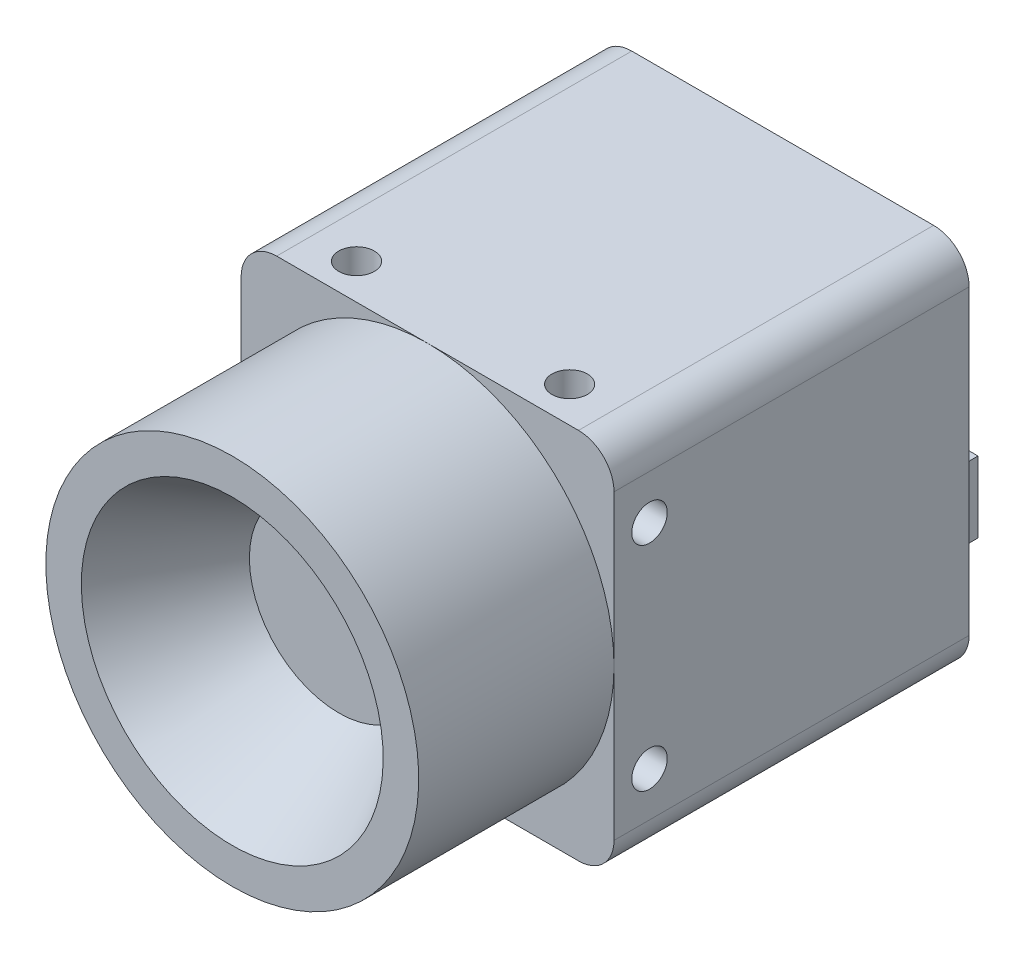
from build123d import *

# Parameters (mm, degrees)
BOSS_EXTRUDE1_DEPTH = 20
SKETCH4_W           = 10
SKETCH4_H           = 4
BOSS_EXTRUDE2_DEPTH = 6
SKETCH5_R           = 1
CUT_EXTRUDE1_DEPTH  = 3
CIRPATTERN1_COUNT   = 4


with BuildPart() as part:
    # Sketch1 → Boss-Extrude1 (new body)
    with BuildSketch(Plane.XY):
        with BuildLine():
            Line((-8.5, -10.5), (8.5, -10.5))
            ThreePointArc((8.5, -10.5), (9.914213562, -9.914213562), (10.5, -8.5))
            Line((10.5, -8.5), (10.5, 8.5))
            ThreePointArc((10.5, 8.5), (9.914213562, 9.914213562), (8.5, 10.5))
            Line((8.5, 10.5), (-8.5, 10.5))
            ThreePointArc((-8.5, 10.5), (-9.914213562, 9.914213562), (-10.5, 8.5))
            Line((-10.5, 8.5), (-10.5, -8.5))
            ThreePointArc((-10.5, -8.5), (-9.914213562, -9.914213562), (-8.5, -10.5))
        make_face()
    extrude(amount=BOSS_EXTRUDE1_DEPTH)

    # Sketch3 → Revolve1 (revolve)
    with BuildSketch(Plane(origin=(0, 0, 0), x_dir=(0, 0, -1), z_dir=(1, 0, 0))):
        Polygon((-20, 10.5), (-20, 0), (-25, 0), (-25, 5.035898385), (-31, 8.5), (-31, 10.5), align=None)
    revolve(axis=Axis((0, 0, 20), (0, 0, 1)))

    # Sketch4 → Boss-Extrude2 (add)
    with BuildSketch(Plane(origin=(0, 0, 0), x_dir=(-1, 0, 0), z_dir=(0, 0, -1))):
        with Locations((0, -7.5)):
            Rectangle(SKETCH4_W, SKETCH4_H)
    extrude(amount=BOSS_EXTRUDE2_DEPTH)

    # Sketch5 → Cut-Extrude1 (cut)
    with BuildSketch(Plane.ZY.offset(10.5)):
        with Locations((18, 6)):
            Circle(SKETCH5_R)
        with Locations((18, -6)):
            Circle(SKETCH5_R)
    cut_extrude1 = extrude(amount=-CUT_EXTRUDE1_DEPTH, mode=Mode.SUBTRACT)

    # CirPattern1: Cut-Extrude1 ×4 about axis
    cirpattern1_axis = Axis((0, 0, 0), (0, 0, 1))
    for i in range(1, CIRPATTERN1_COUNT):
        add(cut_extrude1.rotate(cirpattern1_axis, i * 360 / CIRPATTERN1_COUNT), mode=Mode.SUBTRACT)


solid = part.part
